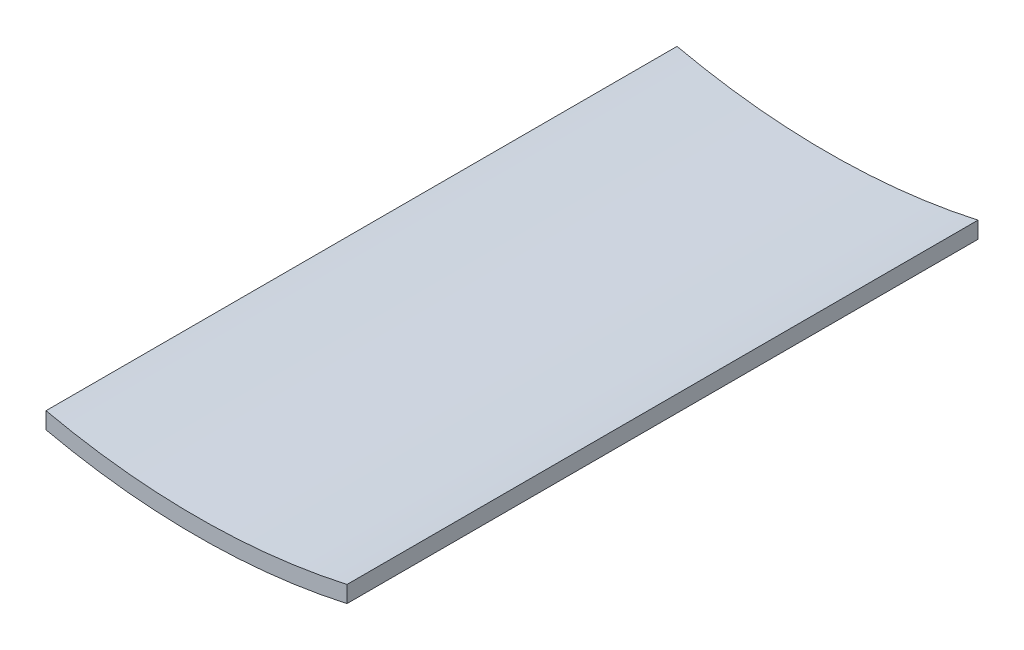
from build123d import *

# Parameters (mm, degrees)
BOSS_EXTRUDE1_DEPTH = 482.6


with BuildPart() as part:
    # Sketch1 → Boss-Extrude1 (new body)
    with BuildSketch(Plane.XY):
        with BuildLine():
            ThreePointArc((230.1875, -12.7), (115.09375, -25.399999708), (0, -12.7))
            Line((0, -12.7), (0, 0))
            ThreePointArc((0, 0), (115.09375, -12.699999708), (230.1875, 0))
            Line((230.1875, 0), (230.1875, -12.7))
        make_face()
    extrude(amount=BOSS_EXTRUDE1_DEPTH)


solid = part.part
